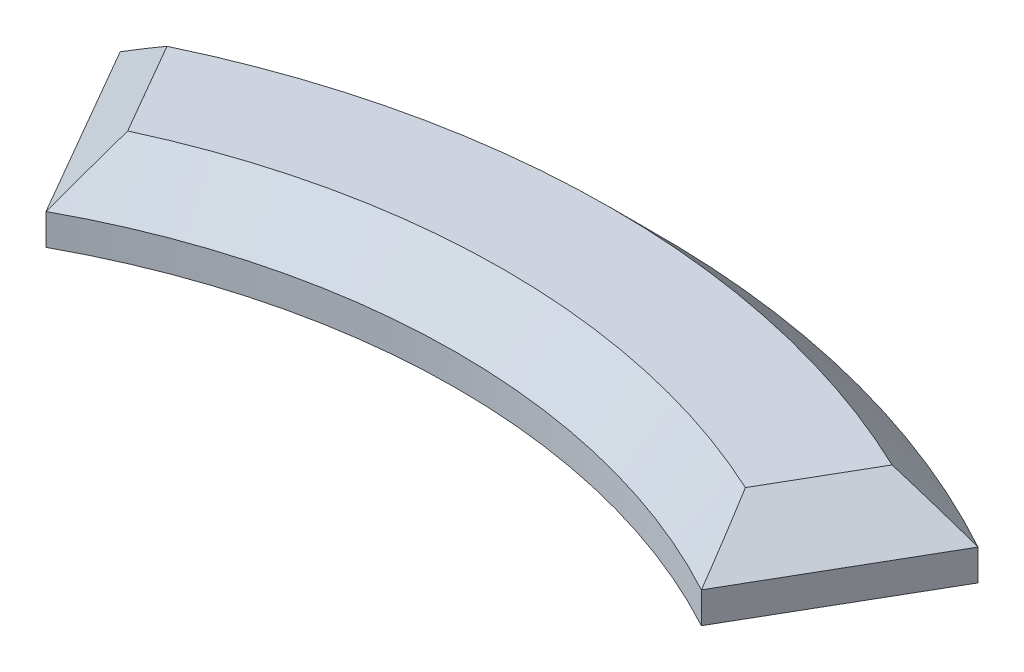
from build123d import *

# Parameters (mm, degrees)
BOSS_EXTRUDE1_DEPTH = 3.3
CHAMFER1_SIZE       = 2
SKETCH2_R           = 1.625
CUT_EXTRUDE1_DEPTH  = 2


with BuildPart() as part:
    # Sketch1 → Boss-Extrude1 (new body)
    with BuildSketch(Plane(origin=(0, 0, 0), x_dir=(1, 0, 0), z_dir=(0, 1, 0))):
        with BuildLine():
            Line((-17.971705397, 32.627906846), (-13.729256498, 25.279769804))
            ThreePointArc((-13.729256498, 25.279769804), (0, 28.767329478), (13.729256498, 25.279769804))
            Line((13.729256498, 25.279769804), (17.971705397, 32.627906846))
            ThreePointArc((17.971705397, 32.627906846), (0, 37.25), (-17.971705397, 32.627906846))
        make_face()
    extrude(amount=BOSS_EXTRUDE1_DEPTH)

    # Chamfer1
    chamfer1_edges = [part.edges().sort_by_distance(p)[0] for p in [
        (0, 3.3, -28.767329478),
        (15.850480947, 3.3, -28.953838325),
        (0, 3.3, -37.25),
        (-15.850480947, 3.3, -28.953838325),
    ]]
    chamfer(chamfer1_edges, length=CHAMFER1_SIZE)

    # Sketch2 → Cut-Extrude1 (cut)
    with BuildSketch(Plane.XZ):
        with Locations(Location((0, -33.008664739, 0), (0, 0, 270))):
            Circle(SKETCH2_R)
    extrude(amount=-CUT_EXTRUDE1_DEPTH, mode=Mode.SUBTRACT)


solid = part.part
